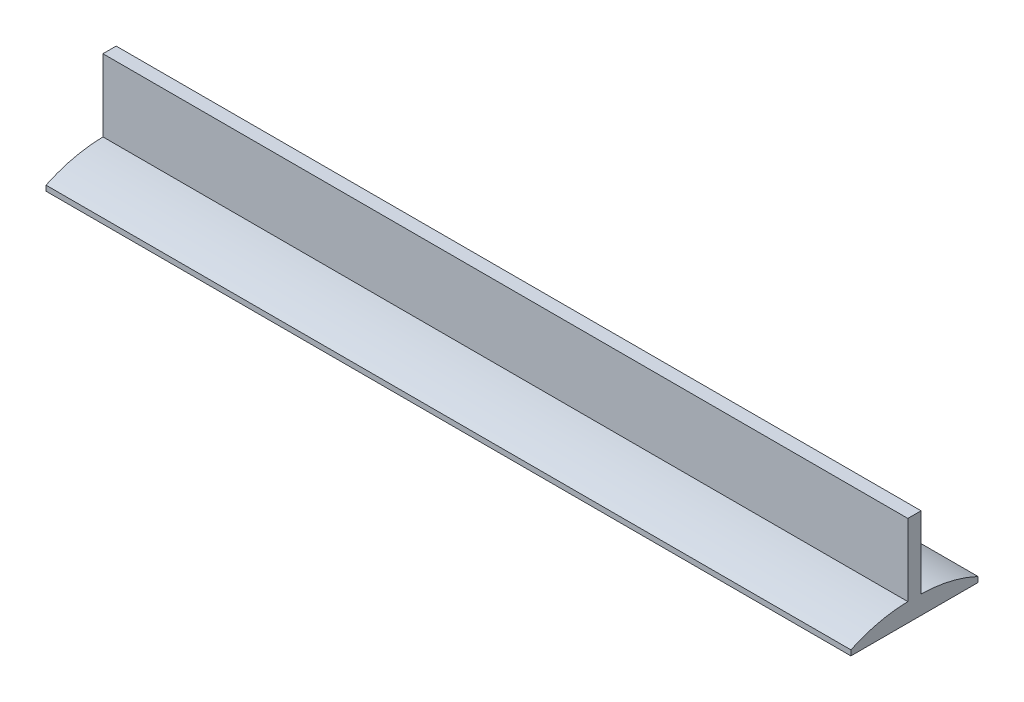
from build123d import *

# Parameters (mm, degrees)
BOSS_EXTRUDE2_DEPTH = 482.6


with BuildPart() as part:
    # Sketch2 → Boss-Extrude2 (new body)
    with BuildSketch(Plane(origin=(0, 0, 0), x_dir=(0, 0, -1), z_dir=(1, 0, 0))):
        with BuildLine():
            Line((0, 0), (0, 54.346487563))
            Line((0, 54.346487563), (3.96875, 54.346487563))
            Line((3.96875, 54.346487563), (3.96875, 11.151453071))
            ThreePointArc((3.96875, 11.151453071), (21.455972099, 8.967240909), (38.1, 3.175))
            Line((38.1, 3.175), (38.1, 0))
            Line((38.1, 0), (0, 0))
        make_face()
    boss_extrude2 = extrude(amount=-BOSS_EXTRUDE2_DEPTH)

    # Mirror1: Boss-Extrude2 across plane
    add(boss_extrude2.mirror(Plane(origin=(-482.6, 0, 0), x_dir=(1, 0, 0), z_dir=(0, 0, 1))))


solid = part.part
